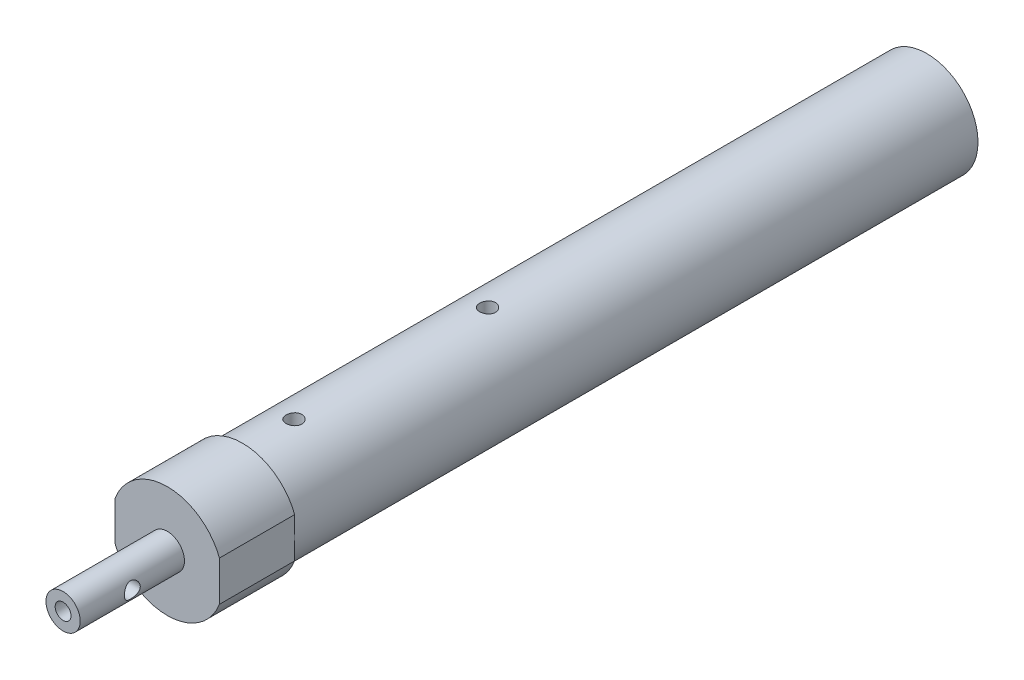
from build123d import *

# Parameters (mm, degrees)
SKETCH1_R                 = 8.73125
BOSS_EXTRUDE1_DEPTH       = 129.54
SKETCH2_R                 = 2.921
BOSS_EXTRUDE2_DEPTH       = 17.78
F_6_32_TAPPED_HOLE1_D     = 2.7051
F_6_32_TAPPED_HOLE2_D     = 2.7051
BOSS_EXTRUDE3_DEPTH       = 12.827
F_6_32_TAPPED_HOLE3_D     = 2.7051
F_6_32_TAPPED_HOLE3_DEPTH = 5.08
F_6_32_TAPPED_HOLE3_TIP   = 0.81269403


with BuildPart() as part:
    # Sketch1 → Boss-Extrude1 (new body)
    with BuildSketch(Plane.XY):
        Circle(SKETCH1_R)
    extrude(amount=BOSS_EXTRUDE1_DEPTH)

    # Sketch2 → Boss-Extrude2 (add)
    with BuildSketch(Plane.XY.offset(129.54)):
        Circle(SKETCH2_R)
    extrude(amount=BOSS_EXTRUDE2_DEPTH)

    # #6-32 Tapped Hole1 (through all)
    with Locations(Plane(origin=(0, 8.73125, 0), x_dir=(1, 0, 0), z_dir=(0, 1, 0))):
        with Locations((0, -74.93), (0, -107.95)):
            Hole(F_6_32_TAPPED_HOLE1_D / 2)

    # #6-32 Tapped Hole2 (through all)
    with Locations(Plane(origin=(2.921, 0, 0), x_dir=(0, 0, -1), z_dir=(1, 0, 0))):
        with Locations((-138.43, 0)):
            Hole(F_6_32_TAPPED_HOLE2_D / 2)

    # Sketch10 → Boss-Extrude3 (add)
    with BuildSketch(Plane.XY.offset(129.54)):
        with BuildLine():
            Line((8.89, -3.419579653), (8.89, 3.419579653))
            ThreePointArc((8.89, 3.419579653), (0, 9.525), (-8.89, 3.419579653))
            Line((-8.89, 3.419579653), (-8.89, -3.419579653))
            ThreePointArc((-8.89, -3.419579653), (0, -9.525), (8.89, -3.419579653))
        make_face()
    extrude(amount=-BOSS_EXTRUDE3_DEPTH)

    # #6-32 Tapped Hole3
    with Locations(Plane.XY.offset(147.32)):
        with Locations((0, 0)):
            Hole(F_6_32_TAPPED_HOLE3_D / 2, depth=F_6_32_TAPPED_HOLE3_DEPTH)
            with Locations((0, 0, -(F_6_32_TAPPED_HOLE3_DEPTH + F_6_32_TAPPED_HOLE3_TIP / 2))):  # 118° drill point
                Cone(0, F_6_32_TAPPED_HOLE3_D / 2, F_6_32_TAPPED_HOLE3_TIP, mode=Mode.SUBTRACT)


solid = part.part
